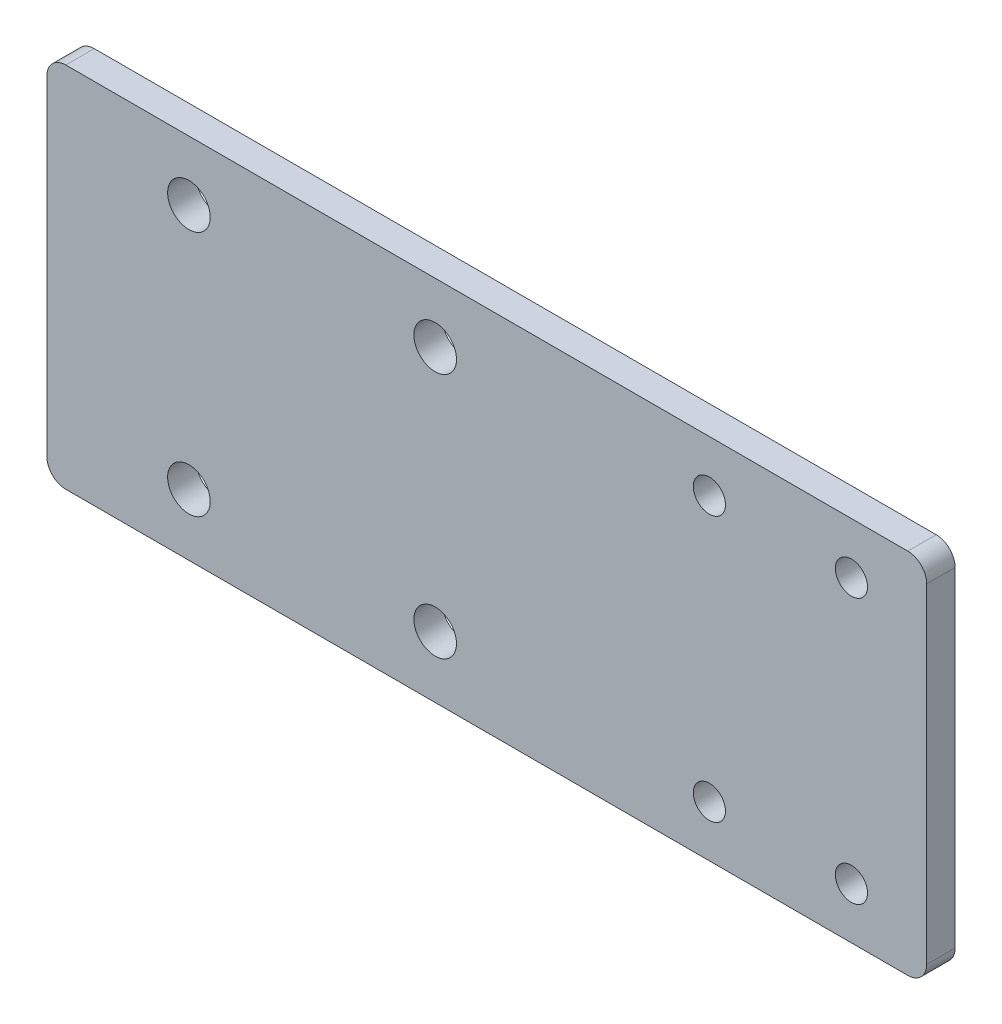
from build123d import *

# Parameters (mm, degrees)
MODEL_R             = 2.25
MODEL_R_2           = 1.7
BOSS_EXTRUDE1_DEPTH = 3


with BuildPart() as part:
    # Model → Boss-Extrude1 (new body)
    with BuildSketch(Plane.XY):
        with BuildLine():
            Line((-75.45, -19.4), (13.45, -19.4))
            ThreePointArc((13.45, -19.4), (14.864213562, -18.814213562), (15.45, -17.4))
            Line((15.45, -17.4), (15.45, 17.4))
            ThreePointArc((15.45, 17.4), (14.864213562, 18.814213562), (13.45, 19.4))
            Line((13.45, 19.4), (-75.45, 19.4))
            ThreePointArc((-75.45, 19.4), (-76.864213562, 18.814213562), (-77.45, 17.4))
            Line((-77.45, 17.4), (-77.45, -17.4))
            ThreePointArc((-77.45, -17.4), (-76.864213562, -18.814213562), (-75.45, -19.4))
        make_face()
        with Locations((-62.45, 13.1)):
            Circle(MODEL_R, mode=Mode.SUBTRACT)
        with Locations((-36.45, 13.1)):
            Circle(MODEL_R, mode=Mode.SUBTRACT)
        with Locations((-36.45, -12.9)):
            Circle(MODEL_R, mode=Mode.SUBTRACT)
        with Locations((-62.45, -12.9)):
            Circle(MODEL_R, mode=Mode.SUBTRACT)
        with Locations((7.5, 14)):
            Circle(MODEL_R_2, mode=Mode.SUBTRACT)
        with Locations((-7.5, 14)):
            Circle(MODEL_R_2, mode=Mode.SUBTRACT)
        with Locations((-7.5, -14)):
            Circle(MODEL_R_2, mode=Mode.SUBTRACT)
        with Locations((7.5, -14)):
            Circle(MODEL_R_2, mode=Mode.SUBTRACT)
    extrude(amount=BOSS_EXTRUDE1_DEPTH)


solid = part.part
